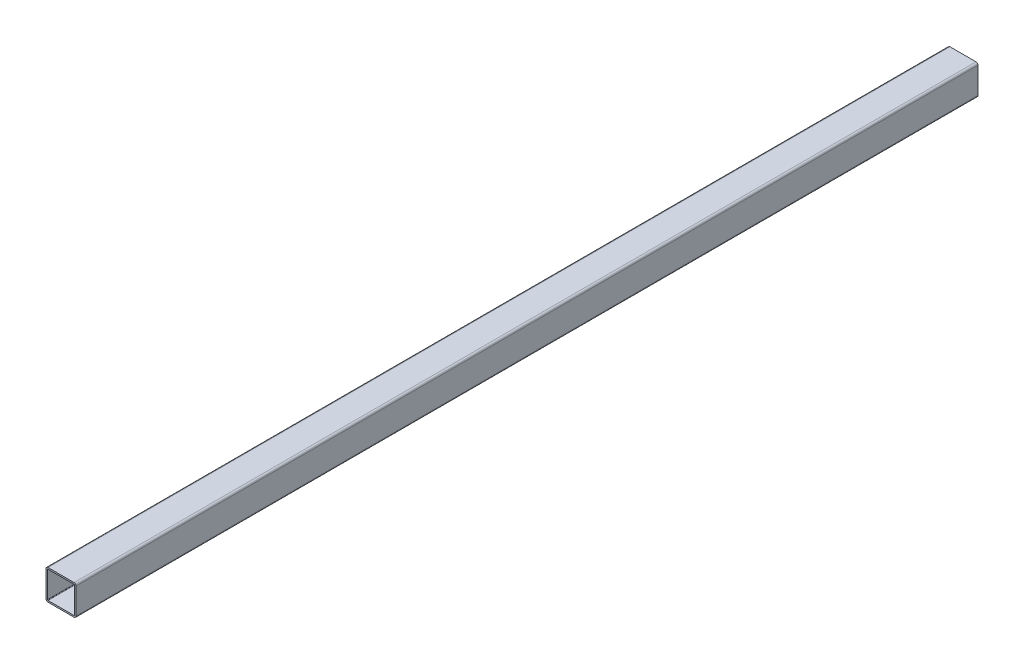
from build123d import *

# Parameters (mm, degrees)
EXTRUDE_1_DEPTH = 900


with BuildPart() as part:
    # Эскиз1 → Вытянуть-Тонкостенный1 (new body)
    with BuildSketch(Plane.XY):
        with BuildLine():
            Line((0, 28), (0, 2))
            ThreePointArc((0, 2), (0.585786438, 0.585786438), (2, 0))
            Line((2, 0), (28, 0))
            ThreePointArc((28, 0), (29.414213562, 0.585786438), (30, 2))
            Line((30, 2), (30, 28))
            ThreePointArc((30, 28), (29.414213562, 29.414213562), (28, 30))
            Line((28, 30), (2, 30))
            ThreePointArc((2, 30), (0.585786438, 29.414213562), (0, 28))
        make_face()
        with BuildLine():
            Line((1.5, 28), (1.5, 2))
            ThreePointArc((1.5, 2), (1.646446609, 1.646446609), (2, 1.5))
            Line((2, 1.5), (28, 1.5))
            ThreePointArc((28, 1.5), (28.353553391, 1.646446609), (28.5, 2))
            Line((28.5, 2), (28.5, 28))
            ThreePointArc((28.5, 28), (28.353553391, 28.353553391), (28, 28.5))
            Line((28, 28.5), (2, 28.5))
            ThreePointArc((2, 28.5), (1.646446609, 28.353553391), (1.5, 28))
        make_face(mode=Mode.SUBTRACT)
    extrude(amount=EXTRUDE_1_DEPTH)


solid = part.part
